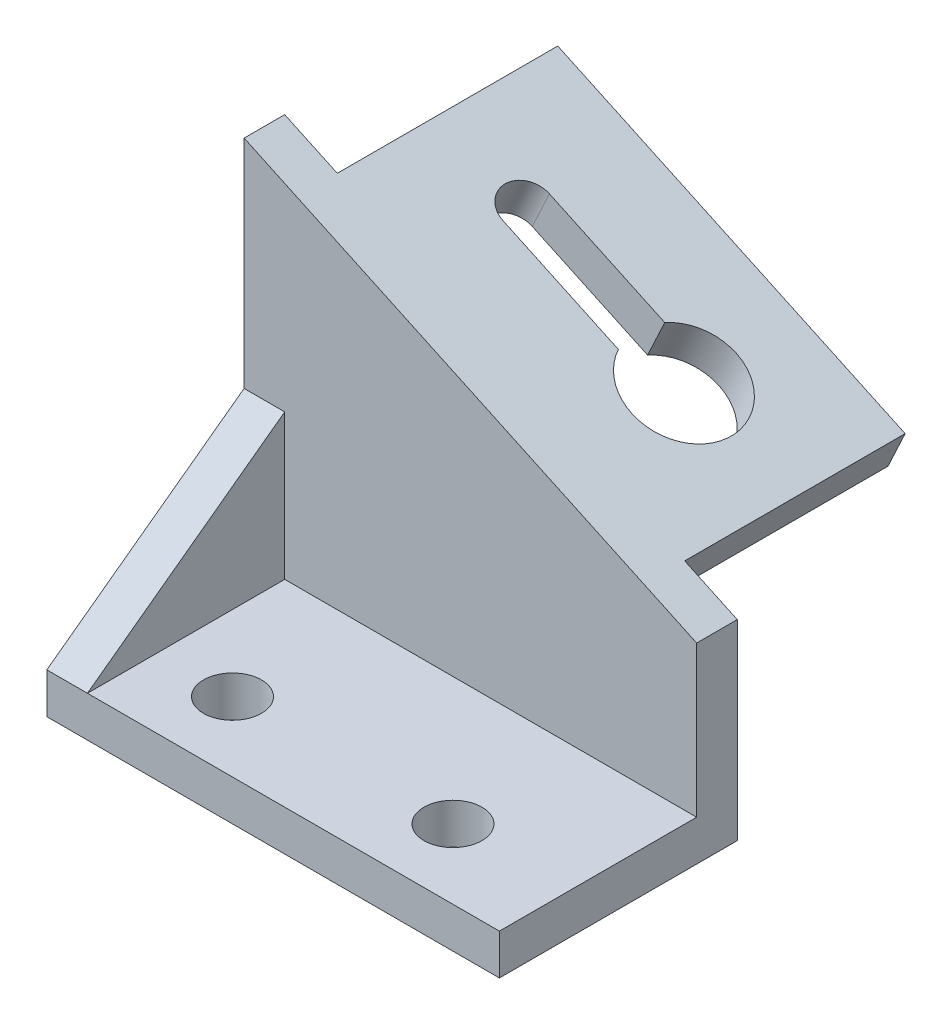
from build123d import *

# Parameters (mm, degrees)
SKETCH6_W           = 78
SKETCH6_H           = 41
SKETCH6_R           = 5
BOSS_EXTRUDE5_DEPTH = 7
BOSS_EXTRUDE6_DEPTH = 7
BOSS_EXTRUDE7_START = -41
BOSS_EXTRUDE7_DEPTH = 7
SKETCH9_W           = 66.063477679
SKETCH9_H           = 38
BOSS_EXTRUDE8_DEPTH = 7


with BuildPart() as part:
    # Sketch6 → Boss-Extrude5 (new body)
    with BuildSketch(Plane(origin=(0, 0, 0), x_dir=(1, 0, 0), z_dir=(0, 1, 0))):
        with Locations((39, 20.5)):
            Rectangle(SKETCH6_W, SKETCH6_H)
        with Locations(Location((20, 12, 0), (0, 0, 270))):
            Circle(SKETCH6_R, mode=Mode.SUBTRACT)
        with Locations(Location((58, 12, 0), (0, 0, 270))):
            Circle(SKETCH6_R, mode=Mode.SUBTRACT)
    extrude(amount=BOSS_EXTRUDE5_DEPTH)

    # Sketch7 → Boss-Extrude6 (add)
    with BuildSketch(Plane(origin=(0, 0, 0), x_dir=(0, 0, -1), z_dir=(1, 0, 0))):
        Polygon((0, 7), (34, 32), (34, 7), align=None)
    extrude(amount=BOSS_EXTRUDE6_DEPTH)

    # Sketch8 → Boss-Extrude7 (add)
    with BuildSketch(Plane.XY.offset(BOSS_EXTRUDE7_START)):
        Polygon((0, 0), (0, 69.371997336), (78, 33), (78, 0), align=None)
    extrude(amount=BOSS_EXTRUDE7_DEPTH)

    # Sketch9 → Boss-Extrude8 (add)
    with BuildSketch(Plane(origin=(26.571016534, 56.981728841, 0), x_dir=(0.9063077870366529, -0.42261826174069334, 0), z_dir=(0.42261826174069334, 0.9063077870366529, 0))):
        with Locations((13.713865912, 60)):
            Rectangle(SKETCH9_W, SKETCH9_H)
        with BuildLine():
            Line((-3.254395249, 63), (18.683347003, 63))
            ThreePointArc((18.683347003, 63), (28.799829698, 67.762428879), (35.745604751, 59))
            ThreePointArc((35.745604751, 59), (28.799829698, 50.237571121), (18.683347003, 55))
            Line((18.683347003, 55), (-3.254395249, 55))
            ThreePointArc((-3.254395249, 55), (-7.254395249, 59), (-3.254395249, 63))
        make_face(mode=Mode.SUBTRACT)
    extrude(amount=-BOSS_EXTRUDE8_DEPTH)


solid = part.part
